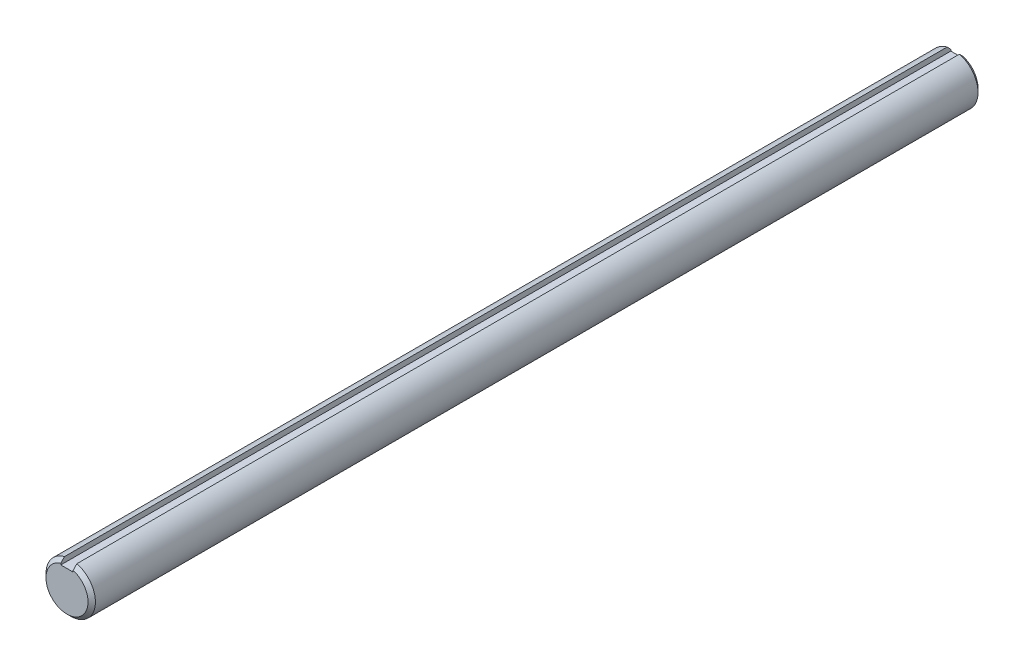
from build123d import *

# Parameters (mm, degrees)
SKETCH1_R           = 6.35
EXTRUDE1_DEPTH      = 114.3
CHAMFER1_SIZE       = 0.9525
EXTRUDE2_DEPTH      = 115.652235041
EXTRUDE2_DEPTH_BACK = 115.652235041
SKETCH3_W           = 3.175
SKETCH3_H           = 1.5875


with BuildPart() as part:
    # Sketch1 → Extrude1 (new, symmetric)
    with BuildSketch(Plane.XY):
        Circle(SKETCH1_R)
    extrude(amount=EXTRUDE1_DEPTH, both=True)

    # Chamfer1
    chamfer1_edges = [part.edges().sort_by_distance(p)[0] for p in [
        (-6.35, 0, -114.3),
        (-6.35, 0, 114.3),
    ]]
    chamfer(chamfer1_edges, length=CHAMFER1_SIZE)

    # Sketch3 → Extrude2 (cut, two sides: drawn at the far end of the back side and taken through both)
    with BuildSketch(Plane.XY.offset(-EXTRUDE2_DEPTH_BACK)):
        with Locations((0, 5.55625)):
            Rectangle(SKETCH3_W, SKETCH3_H)
    extrude(amount=EXTRUDE2_DEPTH + EXTRUDE2_DEPTH_BACK, mode=Mode.SUBTRACT)


solid = part.part
